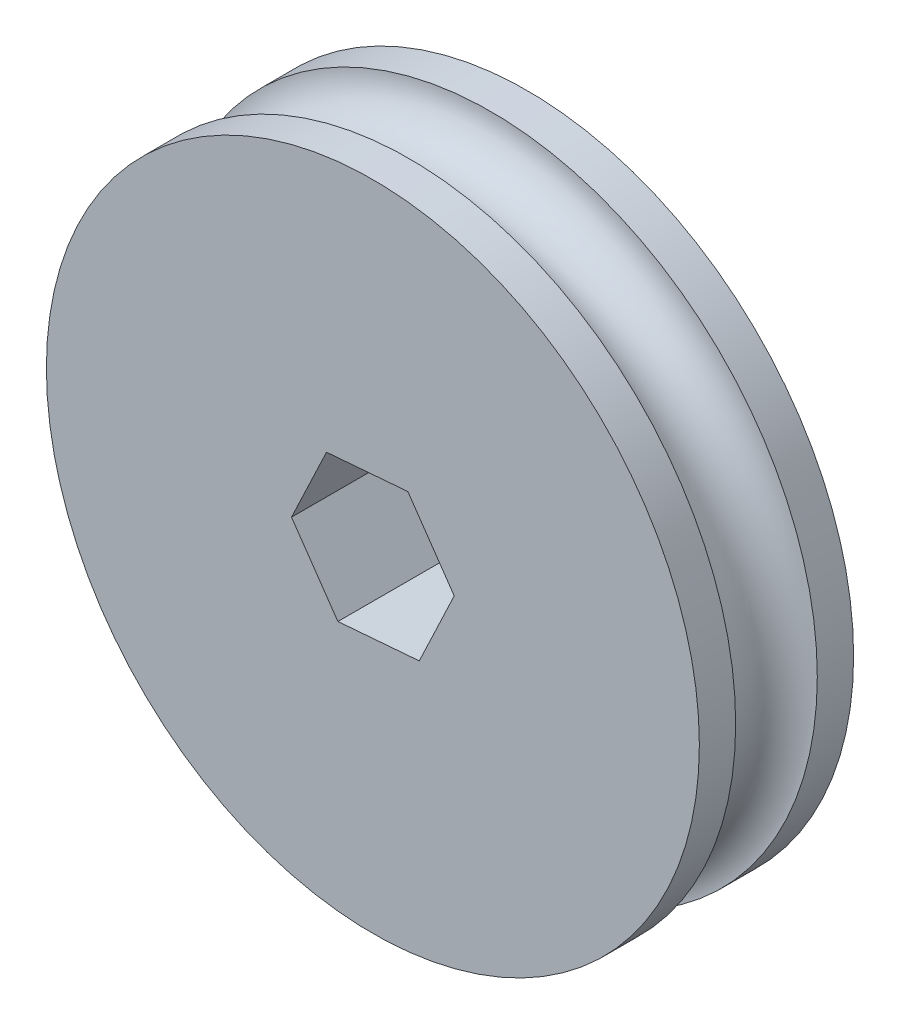
from build123d import *

# Parameters (mm, degrees)
SKETCH2_R           = 12.7
BOSS_EXTRUDE1_DEPTH = 12


with BuildPart() as part:
    # Sketch1 → Revolve1 (revolve)
    with BuildSketch(Plane(origin=(0, 0, 0), x_dir=(1, 0, 0), z_dir=(0, 1, 0))):
        with BuildLine():
            Line((12.7, 0), (25.4, 0))
            Line((25.4, 0), (25.4, 2.825))
            ThreePointArc((25.4, 2.825), (22.225, 6), (25.4, 9.175))
            Line((25.4, 9.175), (25.4, 12))
            Line((25.4, 12), (12.7, 12))
            Line((12.7, 12), (12.7, 0))
        make_face()
    revolve(axis=Axis((0, 0, 0), (0, 0, -1)))

    # Sketch2 → Boss-Extrude1 (add)
    with BuildSketch(Plane.XY):
        Circle(SKETCH2_R)
        Polygon((3.609388519, -5.225480634), (6.330093235, 0.513081832), (2.720704717, 5.738562466), (-3.609388519, 5.225480634), (-6.330093235, -0.513081832), (-2.720704717, -5.738562466), align=None, mode=Mode.SUBTRACT)
    extrude(amount=-BOSS_EXTRUDE1_DEPTH)


solid = part.part
